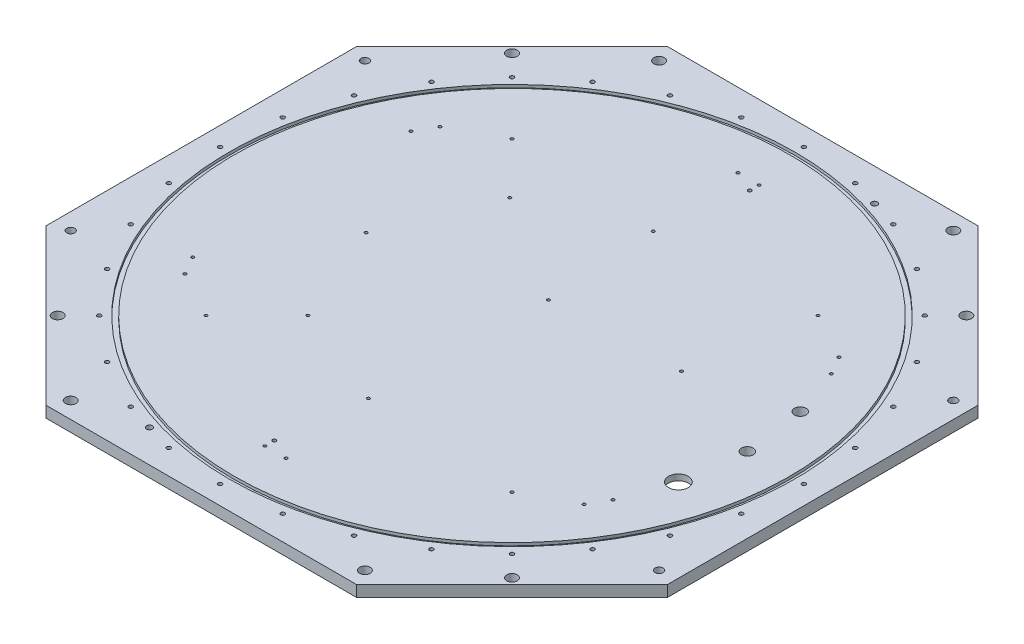
from build123d import *

# Parameters (mm, degrees)
BASE_PLATE_PROFILE_DEPTH                     = 4.7625
M3_CLEARANCE_HOLE_FOR_CYLINDER_D             = 3.4
M3X0_5_TAPPED_HOLE_FOR_SUPPORT_PILLARS_D     = 2.5
M3X0_5_TAPPED_HOLE_FOR_SUPPORT_PILLARS_DEPTH = 7.5
M3X0_5_TAPPED_HOLE_FOR_SUPPORT_PILLARS_TIP   = 0.751075774
F_3_0MM_DOWEL_HOLE_FOR_SUPPORT_PILLARS_D     = 3
F_3_0MM_DOWEL_HOLE_FOR_SUPPORT_PILLARS_DEPTH = 6
F_3_0MM_DOWEL_HOLE_FOR_SUPPORT_PILLARS_TIP   = 0.901290929
M3X0_5_TAPPED_HOLE_FOR_PCB_STANDOFFS_D       = 2.5
M3X0_5_TAPPED_HOLE_FOR_PCB_STANDOFFS_DEPTH   = 6.5
M3X0_5_TAPPED_HOLE_FOR_PCB_STANDOFFS_TIP     = 0.751075774
M8_CLEARANCE_HOLE_FOR_LIFTING_ALIGNM_D       = 9
M8X1_25_TAPPED_HOLE_FOR_SUPER_STRUCTURE_D    = 6.8
F_7_16_20_TAPPED_HOLE_FOR_PENETRATOR_D       = 9.92124
SKETCH28_R                                   = 240.5
SKETCH28_R_2                                 = 236.3344
O_RING_GROOVE_DEPTH                          = 2.413
CIRPATTERN_EXTRACABLES_COUNT                 = 2
CIRPATTERN_EXTRACABLES_ANGLE                 = 15
F_5_8_CLEARANCE_HOLE1_D                      = 16.66748
SKETCH35_R                                   = 18
CUT_EXTRUDE1_DEPTH                           = 4.5
M8_CLEARANCE_HOLE_D                          = 9
F_5_0MM_DOWEL_HOLE1_D                        = 5.05
F_5_0MM_DOWEL_HOLE1_DEPTH                    = 5
F_5_0MM_DOWEL_HOLE1_TIP                      = 1.517173063


with BuildPart() as part:
    # Sketch1 → Base Plate Profile (new, symmetric)
    with BuildSketch(Plane(origin=(0, 0, 0), x_dir=(1, 0, 0), z_dir=(0, 1, 0))):
        Polygon((-131.979797464, 264), (131.979797464, 264), (264, 131.979797464), (264, -131.979797464), (131.979797464, -264), (-131.979797464, -264), (-264, -131.979797464), (-264, 131.979797464), align=None)
    extrude(amount=BASE_PLATE_PROFILE_DEPTH, both=True)

    # M3 Clearance Hole - For Cylinder (through all)
    with Locations(Plane(origin=(0, 4.7625, 0), x_dir=(1, 0, 0), z_dir=(0, 1, 0))):
        with Locations((248, 0), (243.23474954, -48.38239986), (229.122124063, -94.905491227), (206.204463851, -137.781417789), (175.362481734, -175.362481734), (137.781417789, -206.204463851), (94.905491227, -229.122124063), (48.38239986, -243.23474954), (0, -248), (-48.38239986, -243.23474954), (-94.905491227, -229.122124063), (-137.781417789, -206.204463851), (-175.362481734, -175.362481734), (-206.204463851, -137.781417789), (-229.122124063, -94.905491227), (-243.23474954, -48.38239986), (-248, 0), (-243.23474954, 48.38239986), (-229.122124063, 94.905491227), (-206.204463851, 137.781417789), (-175.362481734, 175.362481734), (-137.781417789, 206.204463851), (-94.905491227, 229.122124063), (-48.38239986, 243.23474954), (0, 248), (48.38239986, 243.23474954), (94.905491227, 229.122124063), (137.781417789, 206.204463851), (175.362481734, 175.362481734), (206.204463851, 137.781417789), (229.122124063, 94.905491227), (243.23474954, 48.38239986)):
            Hole(M3_CLEARANCE_HOLE_FOR_CYLINDER_D / 2)

    # M3x0.5 Tapped Hole - For Support Pillars
    with Locations(Plane(origin=(0, 4.7625, 0), x_dir=(1, 0, 0), z_dir=(0, 1, 0))):
        with Locations((-9, 201), (9, 201), (169.571106161, 108.294228634), (178.571106161, 92.705771366), (178.571106161, -92.705771366), (169.571106161, -108.294228634), (9, -201), (-9, -201), (-169.571106161, -108.294228634), (-178.571106161, -92.705771366), (-178.571106161, 92.705771366), (-169.571106161, 108.294228634)):
            Hole(M3X0_5_TAPPED_HOLE_FOR_SUPPORT_PILLARS_D / 2, depth=M3X0_5_TAPPED_HOLE_FOR_SUPPORT_PILLARS_DEPTH)
            with Locations((0, 0, -(M3X0_5_TAPPED_HOLE_FOR_SUPPORT_PILLARS_DEPTH + M3X0_5_TAPPED_HOLE_FOR_SUPPORT_PILLARS_TIP / 2))):  # 118° drill point
                Cone(0, M3X0_5_TAPPED_HOLE_FOR_SUPPORT_PILLARS_D / 2, M3X0_5_TAPPED_HOLE_FOR_SUPPORT_PILLARS_TIP, mode=Mode.SUBTRACT)

    # Ø3.0mm Dowel Hole - For Support Pillars
    with Locations(Plane(origin=(0, 4.7625, 0), x_dir=(1, 0, 0), z_dir=(0, 1, 0))):
        with Locations((9, 193), (-9, -193)):
            Hole(F_3_0MM_DOWEL_HOLE_FOR_SUPPORT_PILLARS_D / 2, depth=F_3_0MM_DOWEL_HOLE_FOR_SUPPORT_PILLARS_DEPTH)
            with Locations((0, 0, -(F_3_0MM_DOWEL_HOLE_FOR_SUPPORT_PILLARS_DEPTH + F_3_0MM_DOWEL_HOLE_FOR_SUPPORT_PILLARS_TIP / 2))):  # 118° drill point
                Cone(0, F_3_0MM_DOWEL_HOLE_FOR_SUPPORT_PILLARS_D / 2, F_3_0MM_DOWEL_HOLE_FOR_SUPPORT_PILLARS_TIP, mode=Mode.SUBTRACT)

    # M3x0.5 Tapped Hole - For PCB Standoffs
    with Locations(Plane(origin=(0, 4.7625, 0), x_dir=(1, 0, 0), z_dir=(0, 1, 0))):
        with Locations((113, 31), (-130, -130), (130, -130), (130, 130), (-130, 130), (-86.8, -86.7), (0, -122), (-123, -1), (-87.7, 85.8), (4, 27), (-2, 122)):
            Hole(M3X0_5_TAPPED_HOLE_FOR_PCB_STANDOFFS_D / 2, depth=M3X0_5_TAPPED_HOLE_FOR_PCB_STANDOFFS_DEPTH)
            with Locations((0, 0, -(M3X0_5_TAPPED_HOLE_FOR_PCB_STANDOFFS_DEPTH + M3X0_5_TAPPED_HOLE_FOR_PCB_STANDOFFS_TIP / 2))):  # 118° drill point
                Cone(0, M3X0_5_TAPPED_HOLE_FOR_PCB_STANDOFFS_D / 2, M3X0_5_TAPPED_HOLE_FOR_PCB_STANDOFFS_TIP, mode=Mode.SUBTRACT)

    # M8 Clearance Hole - For Lifting / Alignment (through all)
    with Locations(Plane(origin=(0, 4.7625, 0), x_dir=(1, 0, 0), z_dir=(0, 1, 0))):
        with Locations((-193.040151264, -193.040151264), (-193.040151264, 193.040151264), (193.040151264, 193.040151264), (193.040151264, -193.040151264)):
            Hole(M8_CLEARANCE_HOLE_FOR_LIFTING_ALIGNM_D / 2)

    # M8x1.25 Tapped Hole -For Super Structure (through all)
    with Locations(Plane(origin=(0, 4.7625, 0), x_dir=(1, 0, 0), z_dir=(0, 1, 0))):
        with Locations((250, 125), (-250, -125), (-250, 125), (250, -125)):
            Hole(M8X1_25_TAPPED_HOLE_FOR_SUPER_STRUCTURE_D / 2)

    # 7/16-20 Tapped Hole - For Penetrator (through all)
    with Locations(Plane(origin=(0, -4.7625, 0), x_dir=(-1, 0, 0), z_dir=(0, -1, 0))):
        with Locations((-200, 0)):
            f_7_16_20_tapped_hole_for_penetrator = Hole(F_7_16_20_TAPPED_HOLE_FOR_PENETRATOR_D / 2)

    # Sketch28 → O-ring Groove (cut)
    with BuildSketch(Plane(origin=(0, 4.7625, 0), x_dir=(1, 0, 0), z_dir=(0, 1, 0))):
        with Locations(Location((0, 0, 0), (0, 0, 270))):
            Circle(SKETCH28_R)
        with Locations(Location((0, 0, 0), (0, 0, 270))):
            Circle(SKETCH28_R_2, mode=Mode.SUBTRACT)
    extrude(amount=-O_RING_GROOVE_DEPTH, mode=Mode.SUBTRACT)

    # CirPattern_extraCables: 7/16-20 Tapped Hole - For Penetrator ×2 about axis
    cirpattern_extracables_axis = Axis((0, -5.23875, 0), (0, 1, 0))
    for i in range(1, CIRPATTERN_EXTRACABLES_COUNT):
        add(f_7_16_20_tapped_hole_for_penetrator.rotate(cirpattern_extracables_axis, i * CIRPATTERN_EXTRACABLES_ANGLE / (CIRPATTERN_EXTRACABLES_COUNT - 1)), mode=Mode.SUBTRACT)

    # 5/8 Clearance Hole1 (through all)
    with Locations(Plane(origin=(0, 4.7625, 0), x_dir=(1, 0, 0), z_dir=(0, 1, 0))):
        with Locations((193.185165258, -51.763809021)):
            Hole(F_5_8_CLEARANCE_HOLE1_D / 2)

    # Sketch35 → Cut-Extrude1 (cut)
    with BuildSketch(Plane.XZ.offset(4.7625)):
        with Locations(Location((193.185165258, 51.763809021, 0), (0, 0, 270))):
            Circle(SKETCH35_R)
    extrude(amount=-CUT_EXTRUDE1_DEPTH, mode=Mode.SUBTRACT)

    # M8 Clearance Hole (through all)
    with Locations(Plane(origin=(-28.123925909, 4.7625, -48.06749493), x_dir=(1, 0, 0), z_dir=(0, 1, 0))):
        with Locations((-96.876074091, -298.06749493), (-96.876074091, 201.93250507), (153.123925909, -298.06749493), (153.123925909, 201.93250507)):
            Hole(M8_CLEARANCE_HOLE_D / 2)

    # Ø5.0mm Dowel Hole1
    with Locations(Plane(origin=(0, 4.7625, 0), x_dir=(1, 0, 0), z_dir=(0, 1, 0))):
        with Locations((71.700315282, 236.364262926), (-71.700315282, -236.364262926)):
            Hole(F_5_0MM_DOWEL_HOLE1_D / 2, depth=F_5_0MM_DOWEL_HOLE1_DEPTH)
            with Locations((0, 0, -(F_5_0MM_DOWEL_HOLE1_DEPTH + F_5_0MM_DOWEL_HOLE1_TIP / 2))):  # 118° drill point
                Cone(0, F_5_0MM_DOWEL_HOLE1_D / 2, F_5_0MM_DOWEL_HOLE1_TIP, mode=Mode.SUBTRACT)


solid = part.part
